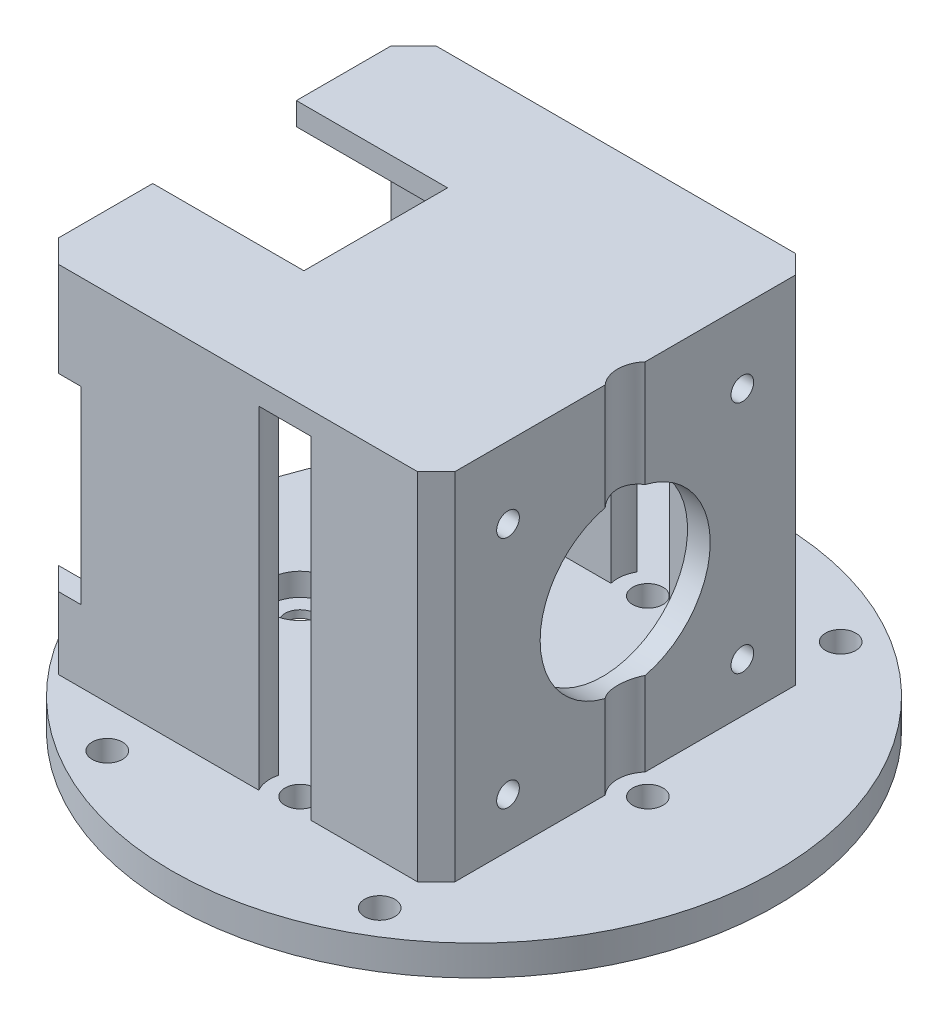
from build123d import *

# Parameters (mm, degrees)
SKETCH_1_R          = 40
SKETCH_1_R_2        = 2
EXTRUDE_1_DEPTH     = 4
EXTRUDE_2_DEPTH     = 44
EXTRUDE_4_DEPTH     = 3
SKETCH_5_R          = 1.5
SKETCH_5_R_2        = 11.25
CUT_EXTRUDE_1_DEPTH = 87.313382508
SKETCH_6_W          = 6
SKETCH_6_H          = 25
CUT_EXTRUDE_2_DEPTH = 3
SKETCH_8_R          = 2
CUT_EXTRUDE_3_DEPTH = 74.545904097
SKETCH_9_R          = 4
CUT_EXTRUDE_4_DEPTH = 3


with BuildPart() as part:
    # 草图1 → 凸台-拉伸1 (new body)
    with BuildSketch(Plane(origin=(0, 0, 0), x_dir=(1, 0, 0), z_dir=(0, 1, 0))):
        with Locations(Location((0, 0, 0), (0, 0, 270))):
            Circle(SKETCH_1_R)
        with Locations(Location((0, 23, 0), (0, 0, 270))):
            Circle(SKETCH_1_R_2, mode=Mode.SUBTRACT)
        with Locations(Location((23, 0, 0), (0, 0, 270))):
            Circle(SKETCH_1_R_2, mode=Mode.SUBTRACT)
        with Locations(Location((0, -23, 0), (0, 0, 270))):
            Circle(SKETCH_1_R_2, mode=Mode.SUBTRACT)
        with Locations(Location((-23, 0, 0), (0, 0, 270))):
            Circle(SKETCH_1_R_2, mode=Mode.SUBTRACT)
    extrude(amount=EXTRUDE_1_DEPTH)

    # 草图2 → 凸台-拉伸2 (add)
    with BuildSketch(Plane(origin=(0, 4, 0), x_dir=(1, 0, 0), z_dir=(0, 1, 0))):
        with BuildLine():
            Line((-33, 22), (-3.872983346, 22))
            ThreePointArc((-3.872983346, 22), (-3.963357659, 23.540181513), (-3.464101615, 25))
            Line((-3.464101615, 25), (-30, 25))
            Line((-30, 25), (-33, 22))
        make_face()
        with BuildLine():
            Line((-33, -22), (-3.872983346, -22))
            ThreePointArc((-3.872983346, -22), (-3.963357659, -23.540181513), (-3.464101615, -25))
            Line((-3.464101615, -25), (-30, -25))
            Line((-30, -25), (-33, -22))
        make_face()
        with BuildLine():
            Line((17, 22), (17, -22))
            Line((17, -22), (3.872983346, -22))
            ThreePointArc((3.872983346, -22), (3.963357659, -23.540181513), (3.464101615, -25))
            Line((3.464101615, -25), (17.525126266, -25))
            Line((17.525126266, -25), (20, -22.525126266))
            Line((20, -22.525126266), (20, -2.645751311))
            ThreePointArc((20, -2.645751311), (19, 0), (20, 2.645751311))
            Line((20, 2.645751311), (20, 22.525126266))
            Line((20, 22.525126266), (17.525126266, 25))
            Line((17.525126266, 25), (3.464101615, 25))
            ThreePointArc((3.464101615, 25), (3.963357659, 23.540181513), (3.872983346, 22))
            Line((3.872983346, 22), (17, 22))
        make_face()
    extrude(amount=EXTRUDE_2_DEPTH)

    # 草图3 → 凸台-拉伸4 (add)
    with BuildSketch(Plane(origin=(0, 48, 0), x_dir=(1, 0, 0), z_dir=(0, 1, 0))):
        with BuildLine():
            Line((-3.464101615, 25), (3.464101615, 25))
            Line((3.464101615, 25), (17.525126266, 25))
            Line((17.525126266, 25), (20, 22.525126266))
            Line((20, 22.525126266), (20, 2.645751311))
            ThreePointArc((20, 2.645751311), (19, 0), (20, -2.645751311))
            Line((20, -2.645751311), (20, -22.525126266))
            Line((20, -22.525126266), (17.525126266, -25))
            Line((17.525126266, -25), (3.464101615, -25))
            Line((3.464101615, -25), (-3.464101615, -25))
            Line((-3.464101615, -25), (-30, -25))
            Line((-30, -25), (-33, -22))
            Line((-33, -22), (-33, -9.5))
            Line((-33, -9.5), (-23, -9.5))
            Line((-23, -9.5), (-13, -9.5))
            Line((-13, -9.5), (-13, -7.5))
            Line((-13, -7.5), (-13, 7.5))
            Line((-13, 7.5), (-13, 9.5))
            Line((-13, 9.5), (-23, 9.5))
            Line((-23, 9.5), (-33, 9.5))
            Line((-33, 9.5), (-33, 22))
            Line((-33, 22), (-30, 25))
            Line((-30, 25), (-3.464101615, 25))
        make_face()
    extrude(amount=EXTRUDE_4_DEPTH)

    # 草图5 → 切除-拉伸1 (cut, through all)
    with BuildSketch(Plane.ZY.offset(-17)):
        with Locations((15.5, 41.5)):
            Circle(SKETCH_5_R)
        with Locations((-15.5, 41.5)):
            Circle(SKETCH_5_R)
        with Locations((-15.5, 10.5)):
            Circle(SKETCH_5_R)
        with Locations((15.5, 10.5)):
            Circle(SKETCH_5_R)
        with Locations((0, 26)):
            Circle(SKETCH_5_R_2)
    extrude(amount=-CUT_EXTRUDE_1_DEPTH, mode=Mode.SUBTRACT)

    # 草图6 → 切除-拉伸2 (cut)
    with BuildSketch(Plane.XY.offset(25)):
        with Locations((-30, 26)):
            Rectangle(SKETCH_6_W, SKETCH_6_H)
    extrude(amount=-CUT_EXTRUDE_2_DEPTH, mode=Mode.SUBTRACT)

    # 草图8 → 切除-拉伸3 (cut, through all)
    with BuildSketch(Plane(origin=(0, 4, 0), x_dir=(1, 0, 0), z_dir=(0, 1, 0))):
        with Locations(Location((18.014281267, 30.496919032, 0), (0, 0, 270))):
            Circle(SKETCH_8_R)
        with Locations(Location((18.014281267, -30.496919032, 0), (0, 0, 90))):
            Circle(SKETCH_8_R)
        with Locations(Location((-18.014281267, -30.496919032, 0), (0, 0, 270))):
            Circle(SKETCH_8_R)
        with Locations(Location((-18.014281267, 30.496919032, 0), (0, 0, 90))):
            Circle(SKETCH_8_R)
    extrude(amount=-CUT_EXTRUDE_3_DEPTH, mode=Mode.SUBTRACT)

    # 草图9 → 切除-拉伸4 (cut)
    with BuildSketch(Plane(origin=(0, 4, 0), x_dir=(1, 0, 0), z_dir=(0, 1, 0))):
        with Locations(Location((-23, 0, 0), (0, 0, 270))):
            Circle(SKETCH_9_R)
    extrude(amount=-CUT_EXTRUDE_4_DEPTH, mode=Mode.SUBTRACT)


solid = part.part
